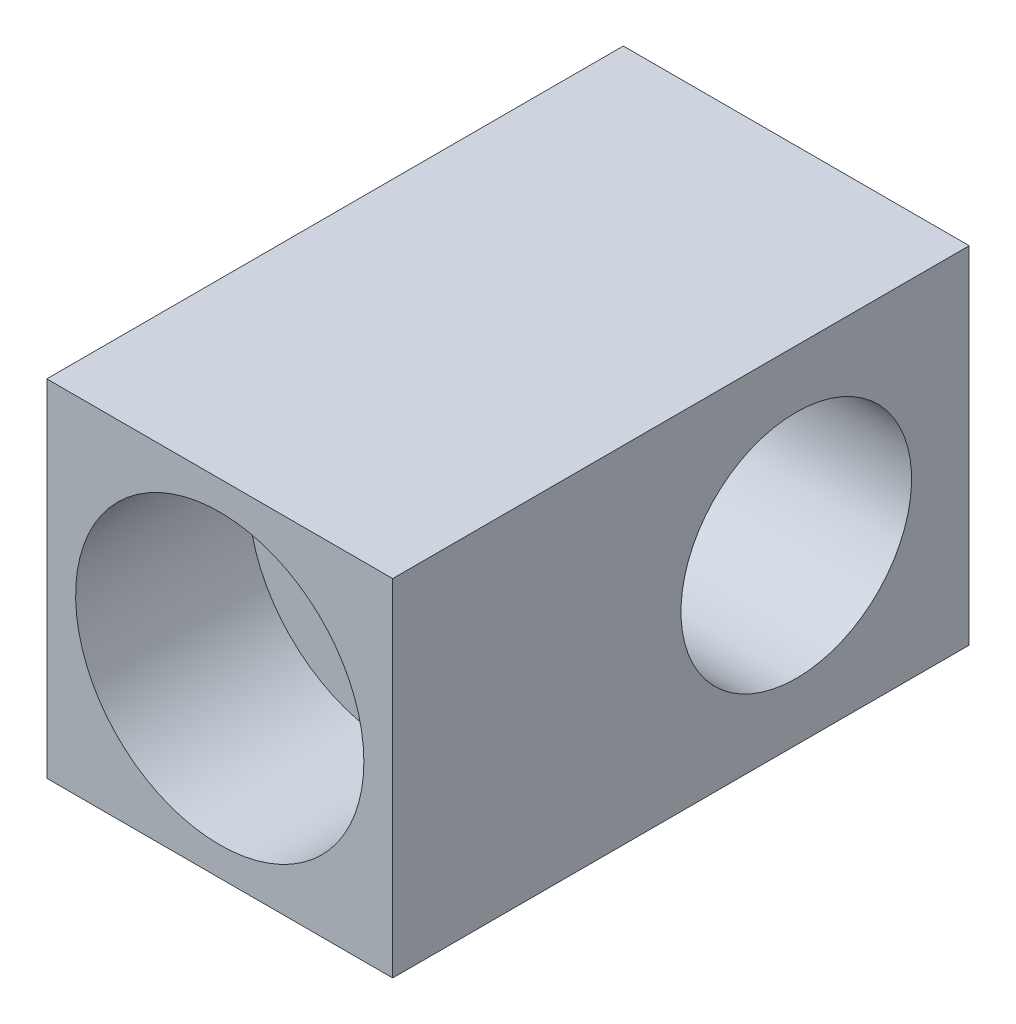
from build123d import *

# Parameters (mm, degrees)
SKETCH1_W           = 3
SKETCH1_H           = 3
BOSS_EXTRUDE2_DEPTH = 6
SKETCH2_R           = 1
CUT_EXTRUDE1_DEPTH  = 6
SKETCH3_R           = 1.25
CUT_EXTRUDE2_DEPTH  = 2.5
SKETCH4_W           = 1
SKETCH4_H           = 3
CUT_EXTRUDE21_DEPTH = 4


with BuildPart() as part:
    # Sketch1 → Boss-Extrude2 (new body)
    with BuildSketch(Plane.XY):
        Rectangle(SKETCH1_W, SKETCH1_H)
    extrude(amount=BOSS_EXTRUDE2_DEPTH)

    # Sketch2 → Cut-Extrude1 (cut)
    with BuildSketch(Plane(origin=(1.5, 0, 0), x_dir=(0, 0, -1), z_dir=(1, 0, 0))):
        with Locations(Location((-1.5, 0, 0), (0, 0, 90))):
            Circle(SKETCH2_R)
    extrude(amount=-CUT_EXTRUDE1_DEPTH, mode=Mode.SUBTRACT)

    # Sketch3 → Cut-Extrude2 (cut)
    with BuildSketch(Plane.XY.offset(6)):
        Circle(SKETCH3_R)
    extrude(amount=-CUT_EXTRUDE2_DEPTH, mode=Mode.SUBTRACT)

    # Sketch4 → Cut-Extrude21 (cut)
    with BuildSketch(Plane(origin=(1.5, 0, 0), x_dir=(0, 0, -1), z_dir=(1, 0, 0))):
        with Locations((-5.5, 0)):
            Rectangle(SKETCH4_W, SKETCH4_H)
    extrude(amount=-CUT_EXTRUDE21_DEPTH, mode=Mode.SUBTRACT)


solid = part.part
